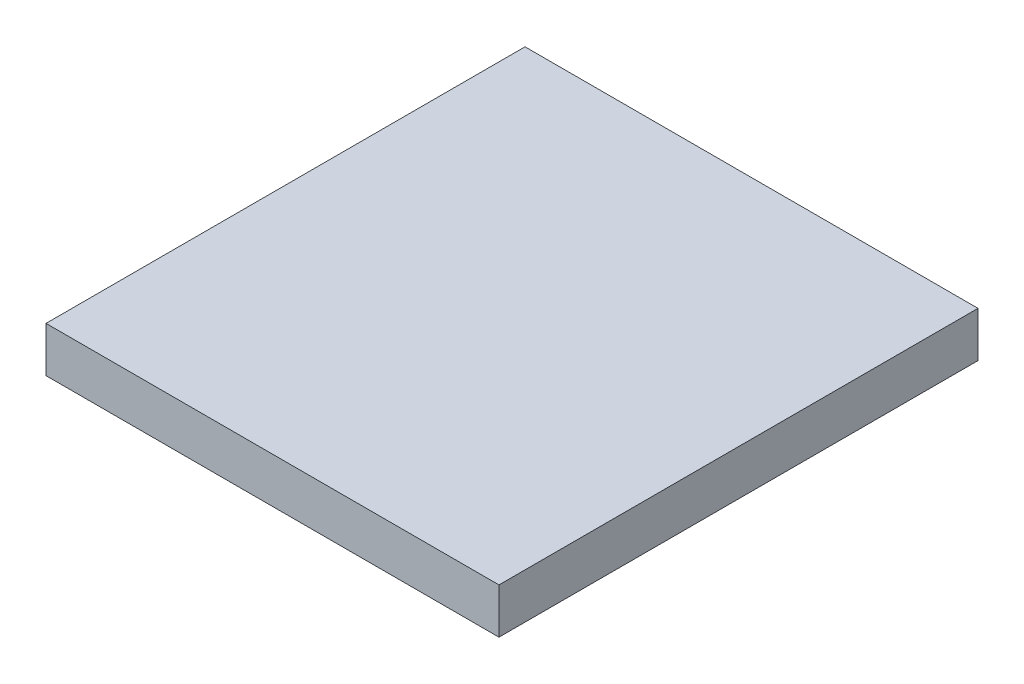
from build123d import *

# Parameters (mm, degrees)
SKETCH1_W           = 40
SKETCH1_H           = 42.3
BOSS_EXTRUDE1_DEPTH = 4


with BuildPart() as part:
    # Sketch1 → Boss-Extrude1 (new body)
    with BuildSketch(Plane(origin=(0, 0, 0), x_dir=(1, 0, 0), z_dir=(0, 1, 0))):
        with Locations((20, -21.15)):
            Rectangle(SKETCH1_W, SKETCH1_H)
    extrude(amount=BOSS_EXTRUDE1_DEPTH)


solid = part.part
